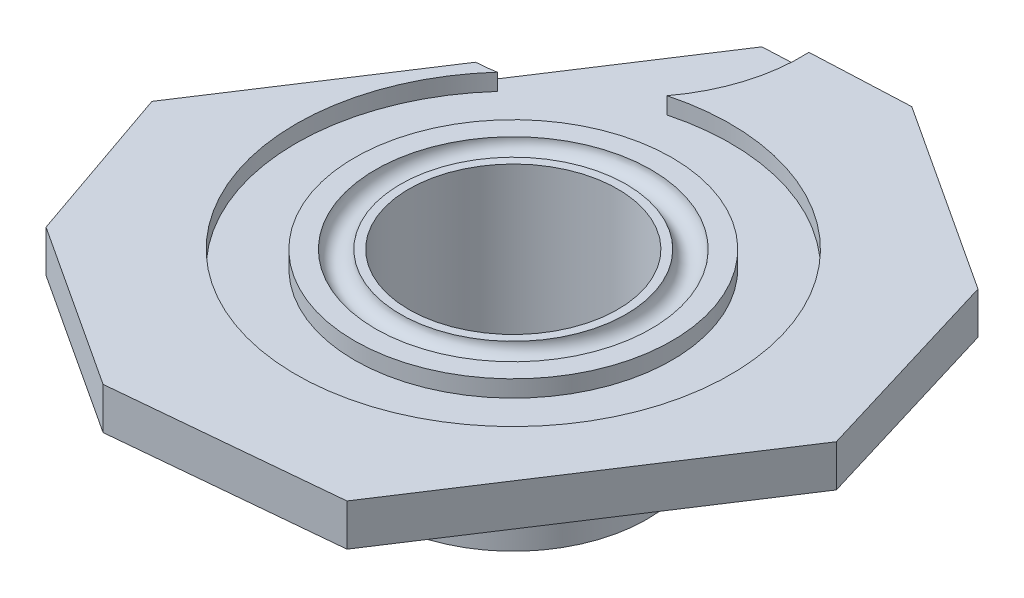
from build123d import *

# Parameters (mm, degrees)
SKETCH_1_R            = 40
SKETCH_1_R_2          = 12.5
EXTRUDE_1_DEPTH       = 20
SKETCH_6_R            = 1.5
SKETCH_12_R           = 43.016285751
SKETCH_12_R_2         = 16
CUT_EXTRUDE_5_DEPTH   = 15
FILLET_2_R            = 5
SKETCH_14_R           = 25.999999999
SKETCH_14_R_2         = 18.999999999
CUT_EXTRUDE_3_DEPTH   = 2
CUT_EXTRUDE_4_DEPTH   = 2
CUT_EXTRUDE_5_2_DEPTH = 10


with BuildPart() as part:
    # Эскиз1 → Вытянуть1 (new body)
    with BuildSketch(Plane(origin=(0, 0, 0), x_dir=(1, 0, 0), z_dir=(0, 1, 0))):
        with Locations(Location((0, 0, 0), (0, 0, 270))):
            Circle(SKETCH_1_R)
        with Locations(Location((0, 0, 0), (0, 0, 270))):
            Circle(SKETCH_1_R_2, mode=Mode.SUBTRACT)
    extrude(amount=EXTRUDE_1_DEPTH)

    # Вырез-По траектории3: sweep along a path in Эскиз4
    with BuildLine(Plane(origin=(0, 20, 0), x_dir=(1, 0, 0), z_dir=(0, 1, 0))) as sweep_3_path:
        CenterArc((0, 0), 15, 0, 360)
    # Эскиз6 → Вырез-По траектории3 (sweep, cut)
    with BuildSketch(Plane(origin=(0, 0, 0), x_dir=(0, 0, -1), z_dir=(1, 0, 0))):
        with Locations((-15, 20)):
            Circle(SKETCH_6_R)
    sweep(path=sweep_3_path.line, mode=Mode.SUBTRACT)

    # Эскиз12 → Cut-Extrude 5 (cut)
    with BuildSketch(Plane.XZ):
        Circle(SKETCH_12_R)
        with Locations(Location((0, 0, 0), (0, 0, 270))):
            Circle(SKETCH_12_R_2, mode=Mode.SUBTRACT)
    extrude(amount=-CUT_EXTRUDE_5_DEPTH, mode=Mode.SUBTRACT)

    # Скругление2
    fillet_2_edges = [part.edges().sort_by_distance(p)[0] for p in [
        (0, 15, 16),
    ]]
    fillet(fillet_2_edges, radius=FILLET_2_R)

    # Эскиз14 → Вырез-Вытянуть3 (cut)
    with BuildSketch(Plane(origin=(0, 20, 0), x_dir=(1, 0, 0), z_dir=(0, 1, 0))):
        with Locations(Location((1.01e-07, 8.4e-08, 0), (0, 0, 270))):
            Circle(SKETCH_14_R)
        with Locations(Location((1.01e-07, 8.4e-08, 0), (0, 0, 270))):
            Circle(SKETCH_14_R_2, mode=Mode.SUBTRACT)
    extrude(amount=-CUT_EXTRUDE_3_DEPTH, mode=Mode.SUBTRACT)

    # Эскиз15 → Вырез-Вытянуть4 (cut)
    with BuildSketch(Plane(origin=(0, 20, 0), x_dir=(1, 0, 0), z_dir=(0, 1, 0))):
        with BuildLine():
            ThreePointArc((-27.297327545, 17.627292527), (-13.760291037, 55.089119116), (-35.71683723, 21.854349851))
            ThreePointArc((-35.71683723, 21.854349851), (-36.252930678, 10.287976674), (-27.297327545, 17.627292527))
        make_face()
    extrude(amount=-CUT_EXTRUDE_4_DEPTH, mode=Mode.SUBTRACT)

    # Эскиз16 → Cut-Extrude 5 2 (cut)
    with BuildSketch(Plane(origin=(0, 20, 0), x_dir=(1, 0, 0), z_dir=(0, 1, 0))):
        Polygon((-7.191454283, -44.519977242), (-37.881198424, -24.469576927), (-45.366952085, 5.371359597), (-23.143023154, 39.387971833), (7.640311576, 44.595915214), (37.770432201, 24.911131357), (45.434410754, -5.233046757), (23.11557492, -39.392615521), align=None)
        Polygon((-8.103935708, 37.866262499), (9.062062667, 38.636931735), (31.933510124, 23.694426018), (39.288073881, -0.614873657), (16.138351941, -36.048532442), (-10.543237541, -38.557583255), (-30.26042154, -25.675839099), (-36.958934768, -6.29707702), align=None, mode=Mode.SUBTRACT)
    extrude(amount=-CUT_EXTRUDE_5_2_DEPTH, mode=Mode.SUBTRACT)


solid = part.part
